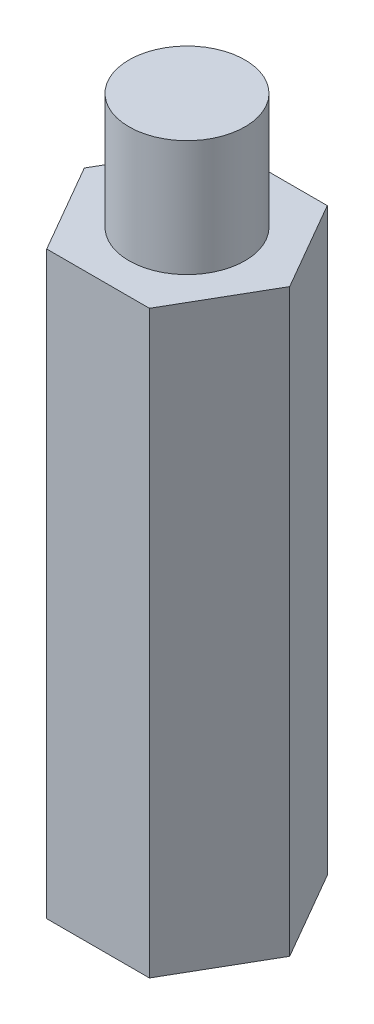
from build123d import *

# Parameters (mm, degrees)
EXTRUDE_1_DEPTH     = 15
SKETCH_2_R          = 1.5
EXTRUDE_2_DEPTH     = 3
SKETCH_3_R          = 1.5
CUT_EXTRUDE_1_DEPTH = 5


with BuildPart() as part:
    # 草图1 → 凸台-拉伸1 (new body)
    with BuildSketch(Plane(origin=(0, 0, 0), x_dir=(1, 0, 0), z_dir=(0, 1, 0))):
        Polygon((2.655811238, 0), (1.327905619, 2.3), (-1.327905619, 2.3), (-2.655811238, 0), (-1.327905619, -2.3), (1.327905619, -2.3), align=None)
    extrude(amount=EXTRUDE_1_DEPTH)

    # 草图2 → 凸台-拉伸2 (add)
    with BuildSketch(Plane(origin=(0, 15, 0), x_dir=(1, 0, 0), z_dir=(0, 1, 0))):
        with Locations(Location((0, 0, 0), (0, 0, 270))):
            Circle(SKETCH_2_R)
    extrude(amount=EXTRUDE_2_DEPTH)

    # 草图3 → 切除-拉伸1 (cut)
    with BuildSketch(Plane.XZ):
        with Locations(Location((0, 0, 0), (0, 0, 90))):
            Circle(SKETCH_3_R)
    extrude(amount=-CUT_EXTRUDE_1_DEPTH, mode=Mode.SUBTRACT)


solid = part.part
